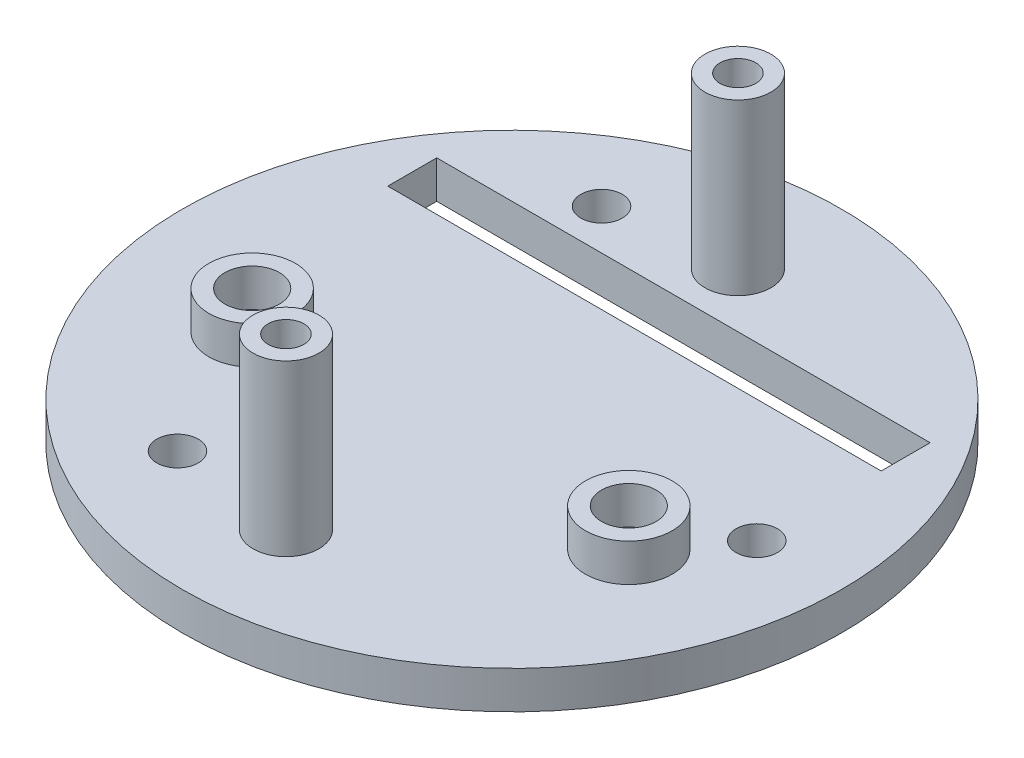
from build123d import *

# Parameters (mm, degrees)
SKETCH_1_R          = 17.5
EXTRUDE_1_DEPTH     = 2
CUT_EXTRUDE_2_REACH = 26.829
SKETCH_1_4_W        = 26.2
SKETCH_1_4_H        = 2.6
SKETCH_1_4_R        = 1.1
SKETCH_1_5_R        = 2.3
SKETCH_1_5_R_2      = 1.45
EXTRUDE_2_DEPTH     = 4
SKETCH_1_6_R        = 1.75
SKETCH_1_6_R_2      = 0.95
EXTRUDE_3_DEPTH     = 11


with BuildPart() as part:
    # 草图1 → 凸台-拉伸1 (new body)
    with BuildSketch(Plane(origin=(0, 0, 0), x_dir=(1, 0, 0), z_dir=(0, 1, 0))):
        with Locations(Location((-4.53e-07, -7.66e-07, 0), (0, 0, 270))):
            Circle(SKETCH_1_R)
    extrude(amount=EXTRUDE_1_DEPTH)

    # 草图1<4> → 切除-拉伸2 (cut, up to next)
    with BuildSketch(Plane(origin=(0, 0, 0), x_dir=(1, 0, 0), z_dir=(0, 1, 0)), mode=Mode.PRIVATE) as cut_extrude_2_sk1:
        with Locations((-4.53e-07, 7.806744123)):
            Rectangle(SKETCH_1_4_W, SKETCH_1_4_H)
    cut_extrude_2_tool1 = extrude(cut_extrude_2_sk1.sketch, amount=CUT_EXTRUDE_2_REACH, mode=Mode.PRIVATE) & part.part
    # 草图1<4> → 切除-拉伸2 (cut, up to next)
    with BuildSketch(Plane(origin=(0, 0, 0), x_dir=(1, 0, 0), z_dir=(0, 1, 0)), mode=Mode.PRIVATE) as cut_extrude_2_sk2:
        with Locations(Location((-6.499999337, -11.258330632, 0), (0, 0, 270))):
            Circle(SKETCH_1_4_R)
    cut_extrude_2_tool2 = extrude(cut_extrude_2_sk2.sketch, amount=CUT_EXTRUDE_2_REACH, mode=Mode.PRIVATE) & part.part
    # 草图1<4> → 切除-拉伸2 (cut, up to next)
    with BuildSketch(Plane(origin=(0, 0, 0), x_dir=(1, 0, 0), z_dir=(0, 1, 0)), mode=Mode.PRIVATE) as cut_extrude_2_sk3:
        with Locations(Location((13, 7.66e-07, 0), (0, 0, 270))):
            Circle(SKETCH_1_4_R)
    cut_extrude_2_tool3 = extrude(cut_extrude_2_sk3.sketch, amount=CUT_EXTRUDE_2_REACH, mode=Mode.PRIVATE) & part.part
    # 草图1<4> → 切除-拉伸2 (cut, up to next)
    with BuildSketch(Plane(origin=(0, 0, 0), x_dir=(1, 0, 0), z_dir=(0, 1, 0)), mode=Mode.PRIVATE) as cut_extrude_2_sk4:
        with Locations(Location((-6.500000663, 11.258329866, 0), (0, 0, 270))):
            Circle(SKETCH_1_4_R)
    cut_extrude_2_tool4 = extrude(cut_extrude_2_sk4.sketch, amount=CUT_EXTRUDE_2_REACH, mode=Mode.PRIVATE) & part.part
    add(cut_extrude_2_tool1.solids().sort_by_distance((0, 0, -7.806744))[0], mode=Mode.SUBTRACT)
    add(cut_extrude_2_tool2.solids().sort_by_distance((-6.499999, 0, 11.258331))[0], mode=Mode.SUBTRACT)
    add(cut_extrude_2_tool3.solids().sort_by_distance((13, 0, -1e-06))[0], mode=Mode.SUBTRACT)
    add(cut_extrude_2_tool4.solids().sort_by_distance((-6.500001, 0, -11.25833))[0], mode=Mode.SUBTRACT)

    # 草图1<5> → 凸台-拉伸2 (add)
    # profile 1 of 2: a face of its own
    with BuildSketch(Plane(origin=(0, 0, 0), x_dir=(1, 0, 0), z_dir=(0, 1, 0))):
        with Locations(Location((-10, -3.793255877, 0), (0, 0, 270))):
            Circle(SKETCH_1_5_R)
        with Locations(Location((-10, -3.793255877, 0), (0, 0, 270))):
            Circle(SKETCH_1_5_R_2, mode=Mode.SUBTRACT)
    # profile 2 of 2: a face of its own
    with BuildSketch(Plane(origin=(0, 0, 0), x_dir=(1, 0, 0), z_dir=(0, 1, 0))):
        with Locations(Location((10, -3.793255877, 0), (0, 0, 270))):
            Circle(SKETCH_1_5_R)
        with Locations(Location((10, -3.793255877, 0), (0, 0, 270))):
            Circle(SKETCH_1_5_R_2, mode=Mode.SUBTRACT)
    extrude(amount=EXTRUDE_2_DEPTH)

    # 草图1<6> → 凸台-拉伸3 (add)
    # profile 1 of 2: a face of its own
    with BuildSketch(Plane(origin=(0, 0, 0), x_dir=(1, 0, 0), z_dir=(0, 1, 0))):
        with Locations(Location((0, 12, 0), (0, 0, 270))):
            Circle(SKETCH_1_6_R)
        with Locations(Location((0, 12, 0), (0, 0, 270))):
            Circle(SKETCH_1_6_R_2, mode=Mode.SUBTRACT)
    # profile 2 of 2: a face of its own
    with BuildSketch(Plane(origin=(0, 0, 0), x_dir=(1, 0, 0), z_dir=(0, 1, 0))):
        with Locations(Location((0.002, -12, 0), (0, 0, 270))):
            Circle(SKETCH_1_6_R)
        with Locations(Location((0.002, -12, 0), (0, 0, 270))):
            Circle(SKETCH_1_6_R_2, mode=Mode.SUBTRACT)
    extrude(amount=EXTRUDE_3_DEPTH)


solid = part.part
